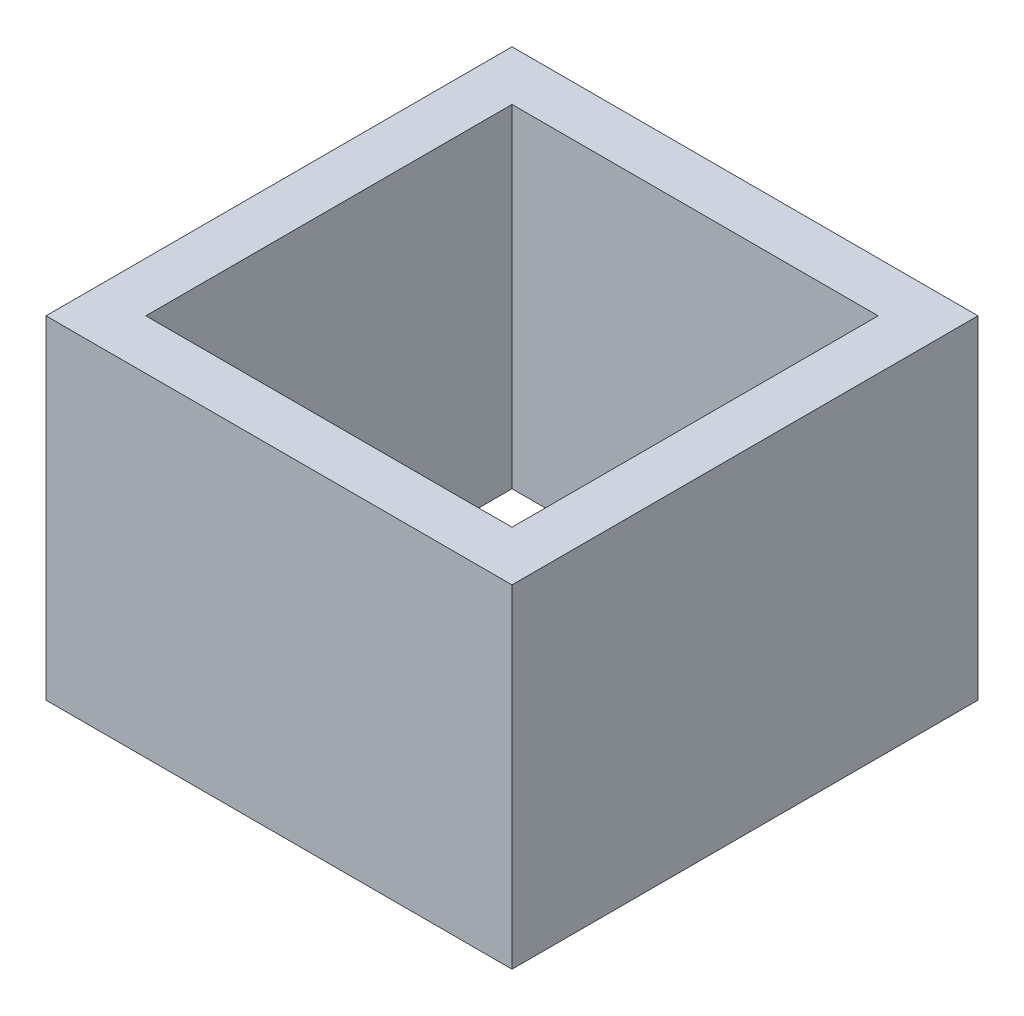
from build123d import *

# Parameters (mm, degrees)
SKETCH_1_W          = 70
SKETCH_1_H          = 70
EXTRUDE_1_DEPTH     = 50
SKETCH_2_W          = 55
SKETCH_2_H          = 55
CUT_EXTRUDE_1_DEPTH = 50


with BuildPart() as part:
    # 草图1 → 凸台-拉伸1 (new body)
    with BuildSketch(Plane(origin=(0, 0, 0), x_dir=(1, 0, 0), z_dir=(0, 1, 0))):
        Rectangle(SKETCH_1_W, SKETCH_1_H)
    extrude(amount=-EXTRUDE_1_DEPTH)

    # 草图2 → 切除-拉伸1 (cut)
    with BuildSketch(Plane(origin=(0, 0, 0), x_dir=(1, 0, 0), z_dir=(0, 1, 0))):
        Rectangle(SKETCH_2_W, SKETCH_2_H)
    extrude(amount=-CUT_EXTRUDE_1_DEPTH, mode=Mode.SUBTRACT)


solid = part.part
